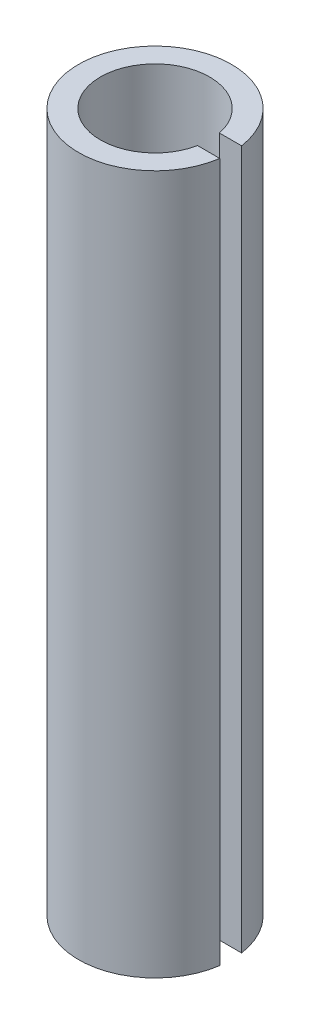
from build123d import *

# Parameters (mm, degrees)
BOSS_EXTRUDE1_DEPTH = 32


with BuildPart() as part:
    # Sketch1 → Boss-Extrude1 (new body)
    with BuildSketch(Plane(origin=(0, 0, 0), x_dir=(1, 0, 0), z_dir=(0, 1, 0))):
        with BuildLine():
            ThreePointArc((2.449489743, -0.5), (-2.5, 0), (2.449489743, 0.5))
            Line((2.449489743, 0.5), (3.464101615, 0.5))
            ThreePointArc((3.464101615, 0.5), (-3.5, 0), (3.464101615, -0.5))
            Line((3.464101615, -0.5), (2.449489743, -0.5))
        make_face()
    extrude(amount=BOSS_EXTRUDE1_DEPTH)


solid = part.part
